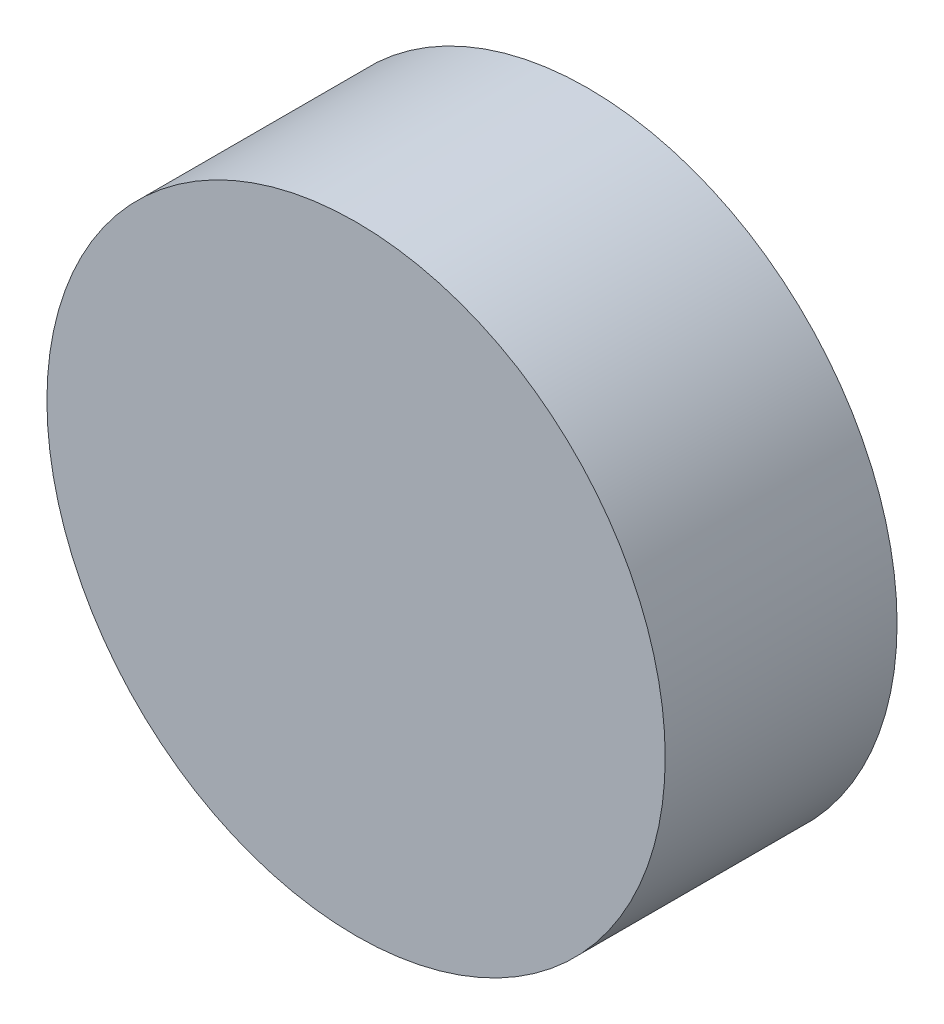
from build123d import *

# Parameters (mm, degrees)
SKETCH1_R           = 5.08
BOSS_EXTRUDE1_DEPTH = 3.81


with BuildPart() as part:
    # Sketch1 → Boss-Extrude1 (new body)
    with BuildSketch(Plane.XY):
        with Locations(Location((0, 0, 0), (0, 0, 180))):
            Circle(SKETCH1_R)
    extrude(amount=BOSS_EXTRUDE1_DEPTH)


solid = part.part
